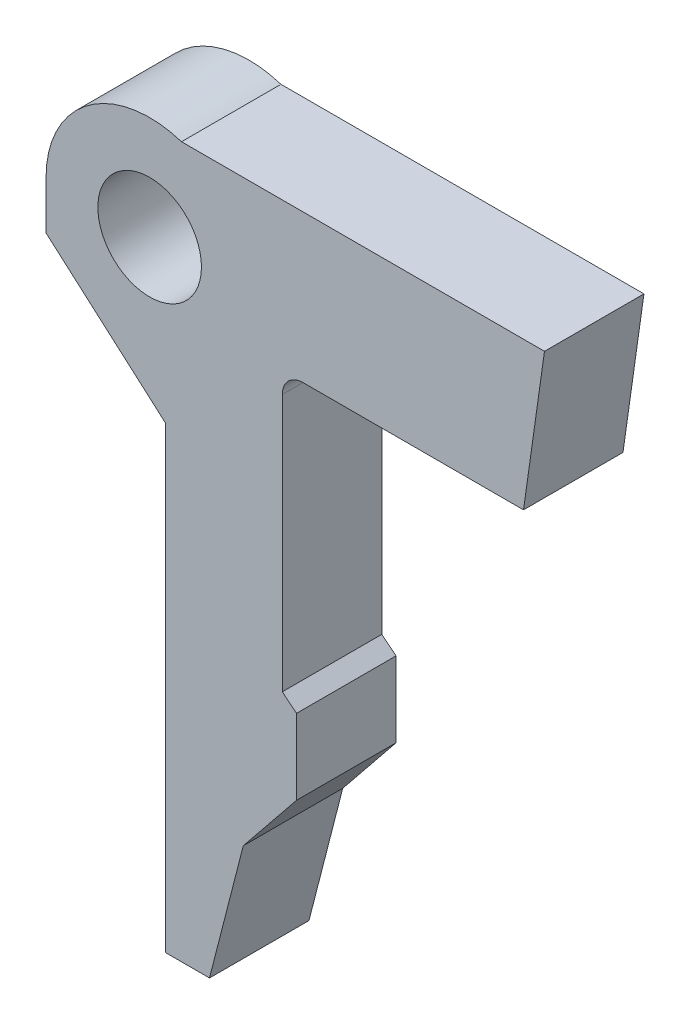
from build123d import *

# Parameters (mm, degrees)
SKETCH_1_R          = 5
SKETCH_1_R_2        = 2.5
EXTRUDE_1_DEPTH     = 4.8
SKETCH_3_R          = 1.825
CUT_EXTRUDE_1_DEPTH = 2


with BuildPart() as part:
    # 스케치1 → 보스-돌출1 (new body)
    # profile 1 of 2: a face of its own
    with BuildSketch(Plane.XY):
        with BuildLine():
            ThreePointArc((5, 0), (0, -5), (-5, 0))
            Line((-5, 0), (-5, -2.326474397))
            Line((-5, -2.326474397), (0.754164722, -7.377840375))
            Line((0.754164722, -7.377840375), (0.754164722, -29.519890116))
            Line((0.754164722, -29.519890116), (2.889052882, -29.519890116))
            Line((2.889052882, -29.519890116), (4.518521564, -23.177422563))
            Line((4.518521564, -23.177422563), (7.08991094, -19.990348408))
            Line((7.08991094, -19.990348408), (7.08991094, -16.35629501))
            Line((7.08991094, -16.35629501), (6.40208237, -15.801342415))
            Line((6.40208237, -15.801342415), (6.40208237, -3.376138068))
            ThreePointArc((6.40208237, -3.376138068), (6.694975589, -2.669031287), (7.40208237, -2.376138068))
            Line((7.40208237, -2.376138068), (18.043960793, -2.376138068))
            Line((18.043960793, -2.376138068), (19.056002599, 4.757997197))
            Line((19.056002599, 4.757997197), (1.536705134, 4.757997197))
            ThreePointArc((1.536705134, 4.757997197), (4.04249463, 2.942488261), (5, 0))
        make_face()
    # profile 2 of 2: a face of its own
    with BuildSketch(Plane.XY):
        Circle(SKETCH_1_R)
        Circle(SKETCH_1_R_2, mode=Mode.SUBTRACT)
    extrude(amount=EXTRUDE_1_DEPTH)

    # 스케치3 → 컷-돌출1 (cut)
    with BuildSketch(Plane.ZY.offset(-0.754164722)):
        with Locations((2.4, -27.019890116)):
            Circle(SKETCH_3_R)
    extrude(amount=-CUT_EXTRUDE_1_DEPTH, mode=Mode.SUBTRACT)


solid = part.part
